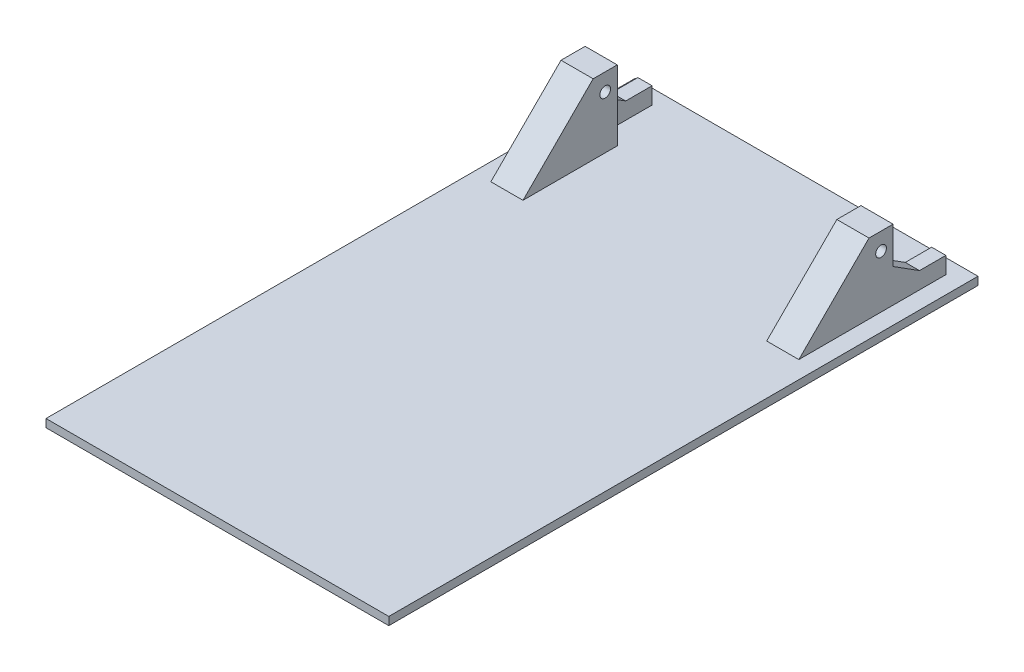
from build123d import *

# Parameters (mm, degrees)
SKETCH1_W           = 64
SKETCH1_H           = 110
BOSS_EXTRUDE1_DEPTH = 1.5
SKETCH2_W           = 6
SKETCH2_H           = 4.5
BOSS_EXTRUDE2_DEPTH = 13.1
BOSS_EXTRUDE3_DEPTH = 2.65
BOSS_EXTRUDE4_DEPTH = 3.35
SKETCH7_R           = 1
CUT_EXTRUDE1_DEPTH  = 6


with BuildPart() as part:
    # Sketch1 → Boss-Extrude1 (new body)
    with BuildSketch(Plane(origin=(0, 0, 0), x_dir=(1, 0, 0), z_dir=(0, 1, 0))):
        Rectangle(SKETCH1_W, SKETCH1_H)
    extrude(amount=BOSS_EXTRUDE1_DEPTH)

    # Sketch2 → Boss-Extrude2 (add)
    with BuildSketch(Plane(origin=(0, 1.5, 0), x_dir=(1, 0, 0), z_dir=(0, 1, 0))):
        with Locations((-25.75, 40.15)):
            Rectangle(SKETCH2_W, SKETCH2_H)
    boss_extrude2 = extrude(amount=BOSS_EXTRUDE2_DEPTH)

    # Sketch3 → Boss-Extrude3 (add)
    with BuildSketch(Plane.ZY.offset(28.75)):
        Polygon((-42.4, 7.75), (-47.325, 4.625), (-52.25, 4.625), (-52.25, 1.5), (-42.4, 1.5), align=None)
        Polygon((-37.9, 14.6), (-24.8, 1.5), (-37.9, 1.5), align=None)
    boss_extrude3 = extrude(amount=-BOSS_EXTRUDE3_DEPTH)

    # Sketch6 → Boss-Extrude4 (add)
    with BuildSketch(Plane(origin=(-26.1, 0, 0), x_dir=(0, 0, -1), z_dir=(1, 0, 0))):
        Polygon((24.8, 1.5), (37.9, 1.5), (37.9, 14.6), align=None)
    boss_extrude4 = extrude(amount=BOSS_EXTRUDE4_DEPTH)

    # Sketch7 → Cut-Extrude1 (cut)
    with BuildSketch(Plane.ZY.offset(28.75)):
        with Locations((-40.15, 11.35)):
            Circle(SKETCH7_R)
    cut_extrude1 = extrude(amount=-CUT_EXTRUDE1_DEPTH, mode=Mode.SUBTRACT)

    # Mirror1: Boss-Extrude2, Boss-Extrude3, Boss-Extrude4, Cut-Extrude1 across plane
    add(boss_extrude2.mirror(Plane(origin=(0, 0, 0), x_dir=(0, 0, 1), z_dir=(1, 0, 0))))
    add(boss_extrude3.mirror(Plane(origin=(0, 0, 0), x_dir=(0, 0, 1), z_dir=(1, 0, 0))))
    add(boss_extrude4.mirror(Plane(origin=(0, 0, 0), x_dir=(0, 0, 1), z_dir=(1, 0, 0))))
    add(cut_extrude1.mirror(Plane(origin=(0, 0, 0), x_dir=(0, 0, 1), z_dir=(1, 0, 0))), mode=Mode.SUBTRACT)


solid = part.part
